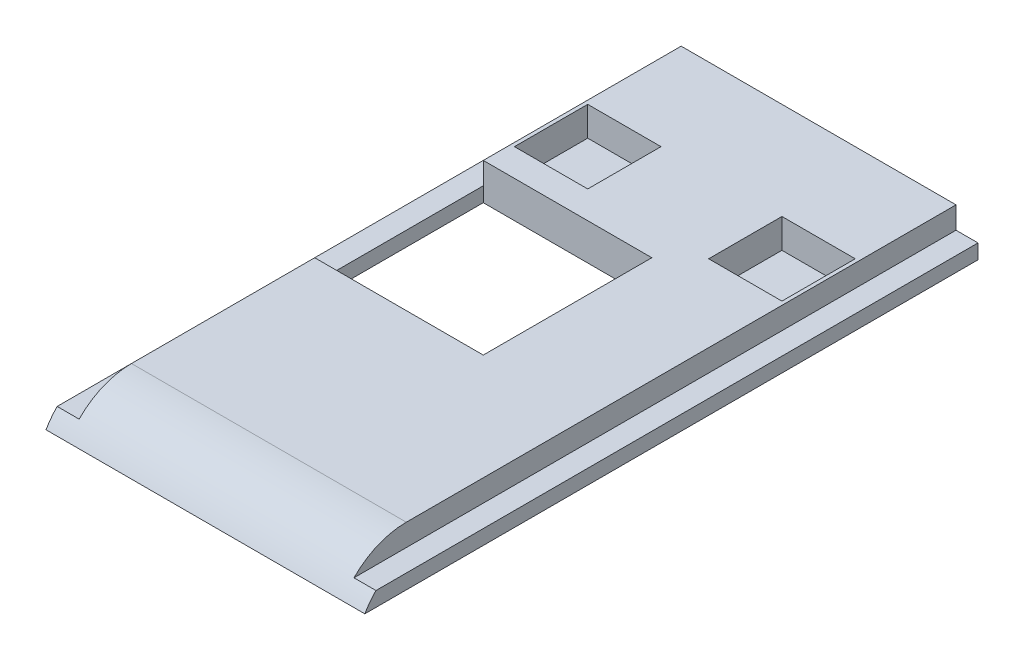
from build123d import *

# Parameters (mm, degrees)
SKICA1_W                 = 17.4
SKICA1_H                 = 27
P_IDAT_VYSUNUT_M1_DEPTH  = 2
SKICA2_W                 = 17.4
SKICA2_H                 = 27
P_IDAT_VYSUNUT_M2_DEPTH  = 6
ZAOBLIT1_R               = 4
SKICA3_W                 = 17.4
SKICA3_H                 = 27
ODEBRAT_VYSUNUT_M1_DEPTH = 6
SKICA4_W                 = 1.2
SKICA4_H                 = 26.464101615
ODEBRAT_VYSUNUT_M2_DEPTH = 1.2
SKICA7_W                 = 15
SKICA7_H                 = 1.2
SKICA7_W_2               = 17.4
SKICA7_H_2               = 0.8
P_IDAT_VYSUNUT_M3_DEPTH  = 7
SKICA8_W                 = 9.2
SKICA8_H                 = 9.2
ODEBRAT_VYSUNUT_M5_DEPTH = 7
SKICA10_W                = 4
SKICA10_H                = 4
ODEBRAT_VYSUNUT_M6_DEPTH = 1.6


with BuildPart() as part:
    # Skica1 → Přidat vysunutím1 (new body)
    with BuildSketch(Plane(origin=(0, 0, 0), x_dir=(1, 0, 0), z_dir=(0, 1, 0))):
        with Locations((8.7, 13.5)):
            Rectangle(SKICA1_W, SKICA1_H)
    extrude(amount=P_IDAT_VYSUNUT_M1_DEPTH)

    # Skica2 → Přidat vysunutím2 (add)
    with BuildSketch(Plane.XZ):
        with Locations((8.7, -13.5)):
            Rectangle(SKICA2_W, SKICA2_H)
    extrude(amount=P_IDAT_VYSUNUT_M2_DEPTH)

    # Zaoblit1
    zaoblit1_edges = [part.edges().sort_by_distance(p)[0] for p in [
        (8.7, 2, 0),
    ]]
    fillet(zaoblit1_edges, radius=ZAOBLIT1_R)

    # Skica3 → Odebrat vysunutím1 (cut)
    with BuildSketch(Plane.XZ.offset(6)):
        with Locations((8.7, -13.5)):
            Rectangle(SKICA3_W, SKICA3_H)
    extrude(amount=-ODEBRAT_VYSUNUT_M1_DEPTH, mode=Mode.SUBTRACT)

    # Skica4 → Odebrat vysunutím2 (cut)
    with BuildSketch(Plane(origin=(0, 2, 0), x_dir=(1, 0, 0), z_dir=(0, 1, 0))):
        with Locations((0.6, 13.767949192)):
            Rectangle(SKICA4_W, SKICA4_H)
        with Locations((16.8, 13.767949192)):
            Rectangle(SKICA4_W, SKICA4_H)
    extrude(amount=-ODEBRAT_VYSUNUT_M2_DEPTH, mode=Mode.SUBTRACT)

    # Skica7 → Přidat vysunutím3 (add)
    with BuildSketch(Plane(origin=(0, 0, -27), x_dir=(-1, 0, 0), z_dir=(0, 0, -1))):
        with Locations((-8.7, 1.4)):
            Rectangle(SKICA7_W, SKICA7_H)
        with Locations((-8.7, 0.4)):
            Rectangle(SKICA7_W_2, SKICA7_H_2)
    extrude(amount=P_IDAT_VYSUNUT_M3_DEPTH)

    # Skica8 → Odebrat vysunutím5 (cut)
    with BuildSketch(Plane(origin=(0, 2, 0), x_dir=(1, 0, 0), z_dir=(0, 1, 0))):
        with Locations((5.8, 18.6)):
            Rectangle(SKICA8_W, SKICA8_H)
    extrude(amount=-ODEBRAT_VYSUNUT_M5_DEPTH, mode=Mode.SUBTRACT)

    # Skica10 → Odebrat vysunutím6 (cut)
    with BuildSketch(Plane(origin=(0, 2, 0), x_dir=(1, 0, 0), z_dir=(0, 1, 0))):
        with Locations((3.4, 26.7)):
            Rectangle(SKICA10_W, SKICA10_H)
        with Locations((14, 26.7)):
            Rectangle(SKICA10_W, SKICA10_H)
    extrude(amount=-ODEBRAT_VYSUNUT_M6_DEPTH, mode=Mode.SUBTRACT)


solid = part.part
